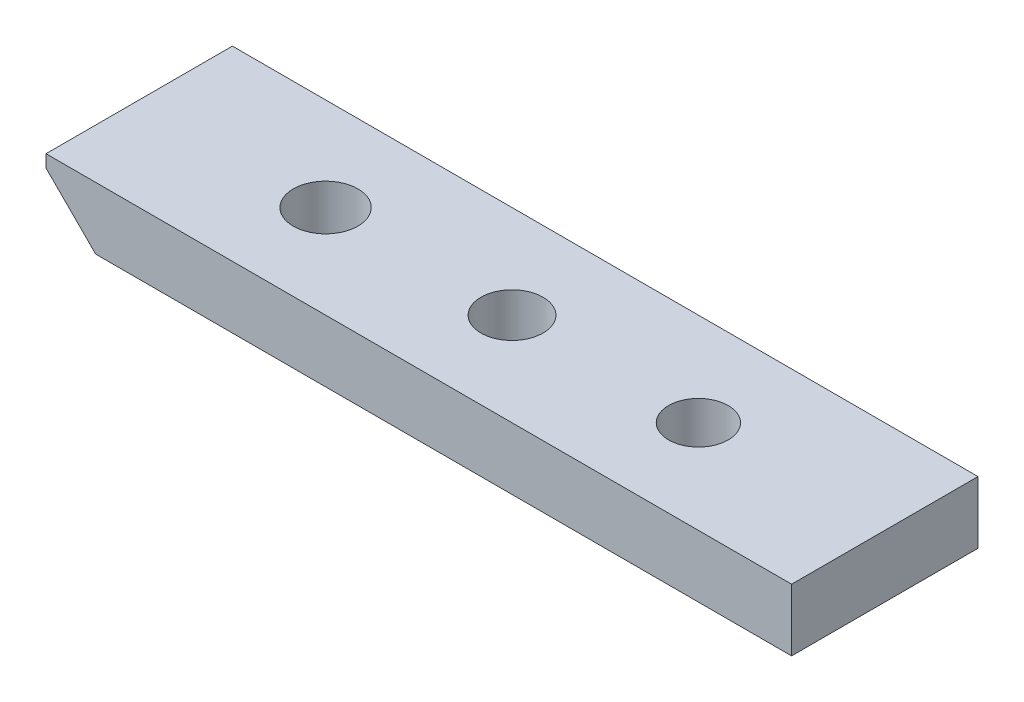
from build123d import *

# Parameters (mm, degrees)
SKETCH1_W           = 38.1
SKETCH1_H           = 9.525
BOSS_EXTRUDE1_DEPTH = 3.175
SKETCH2_R           = 1.651
SKETCH2_R_2         = 1.5875
SKETCH2_R_3         = 1.524
CUT_EXTRUDE1_DEPTH  = 30.142626104
CHAMFER1_SIZE       = 2.54


with BuildPart() as part:
    # Sketch1 → Boss-Extrude1 (new body)
    with BuildSketch(Plane(origin=(0, 0, 0), x_dir=(1, 0, 0), z_dir=(0, 1, 0))):
        with Locations((-9.525, 0)):
            Rectangle(SKETCH1_W, SKETCH1_H)
    extrude(amount=BOSS_EXTRUDE1_DEPTH)

    # Sketch2 → Cut-Extrude1 (cut, through all)
    with BuildSketch(Plane.XZ):
        with Locations(Location((-19.05, 0, 0), (0, 0, 270))):
            Circle(SKETCH2_R)
        with Locations(Location((-9.525, 0, 0), (0, 0, 270))):
            Circle(SKETCH2_R_2)
        with Locations(Location((0, 0, 0), (0, 0, 270))):
            Circle(SKETCH2_R_3)
    extrude(amount=-CUT_EXTRUDE1_DEPTH, mode=Mode.SUBTRACT)

    # Chamfer1
    chamfer1_edges = [part.edges().sort_by_distance(p)[0] for p in [
        (-28.575, 0, 0),
    ]]
    chamfer(chamfer1_edges, length=CHAMFER1_SIZE)


solid = part.part
